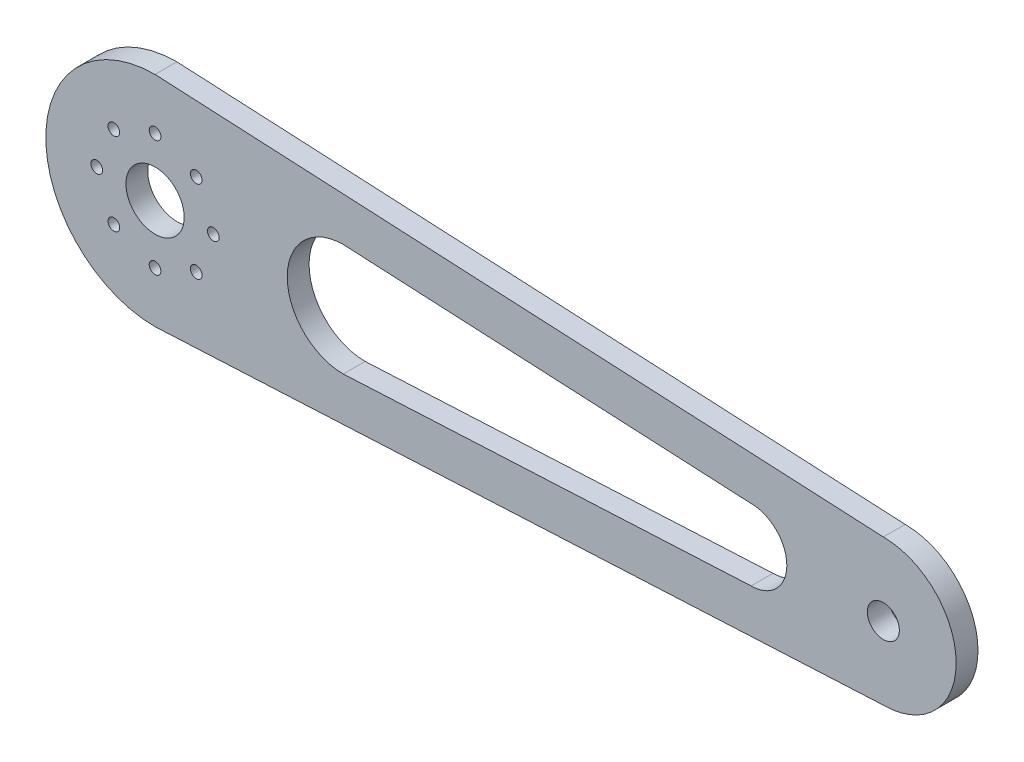
from build123d import *

# Parameters (mm, degrees)
BOSS_EXTRU_1_DEPTH      = 1.5
BOSS_EXTRU_1_DEPTH_BACK = 1.5
ESQUISSE1_R             = 0.8
ESQUISSE1_R_2           = 2.2
ESQUISSE1_R_3           = 4


with BuildPart() as part:
    # Esquisse1 → Boss.-Extru.1 (new, two sides: drawn at the far end of the back side and taken through both)
    with BuildSketch(Plane.XY.offset(-BOSS_EXTRU_1_DEPTH_BACK)):
        with BuildLine():
            Line((0, -15), (100, -10))
            ThreePointArc((100, -10), (110, 0), (100, 10))
            Line((100, 10), (0, 15))
            ThreePointArc((0, 15), (-15, 0), (0, -15))
        make_face()
        with Locations((5.656854249, 5.656854249)):
            Circle(ESQUISSE1_R, mode=Mode.SUBTRACT)
        with Locations((8, 0)):
            Circle(ESQUISSE1_R, mode=Mode.SUBTRACT)
        with Locations((5.656854249, -5.656854249)):
            Circle(ESQUISSE1_R, mode=Mode.SUBTRACT)
        with Locations((0, -8)):
            Circle(ESQUISSE1_R, mode=Mode.SUBTRACT)
        with Locations((100, 0)):
            Circle(ESQUISSE1_R_2, mode=Mode.SUBTRACT)
        Circle(ESQUISSE1_R_3, mode=Mode.SUBTRACT)
        with Locations((-5.656854249, -5.656854249)):
            Circle(ESQUISSE1_R, mode=Mode.SUBTRACT)
        with Locations((-8, 0)):
            Circle(ESQUISSE1_R, mode=Mode.SUBTRACT)
        with Locations((-5.656854249, 5.656854249)):
            Circle(ESQUISSE1_R, mode=Mode.SUBTRACT)
        with Locations((0, 8)):
            Circle(ESQUISSE1_R, mode=Mode.SUBTRACT)
        with BuildLine():
            Line((25.850093633, 7.7), (81.850093633, 4.9))
            ThreePointArc((81.850093633, 4.9), (86.750093633, 0), (81.850093633, -4.9))
            Line((81.850093633, -4.9), (25.850093633, -7.7))
            ThreePointArc((25.850093633, -7.7), (18.150093633, 0), (25.850093633, 7.7))
        make_face(mode=Mode.SUBTRACT)
    extrude(amount=BOSS_EXTRU_1_DEPTH + BOSS_EXTRU_1_DEPTH_BACK)


solid = part.part
